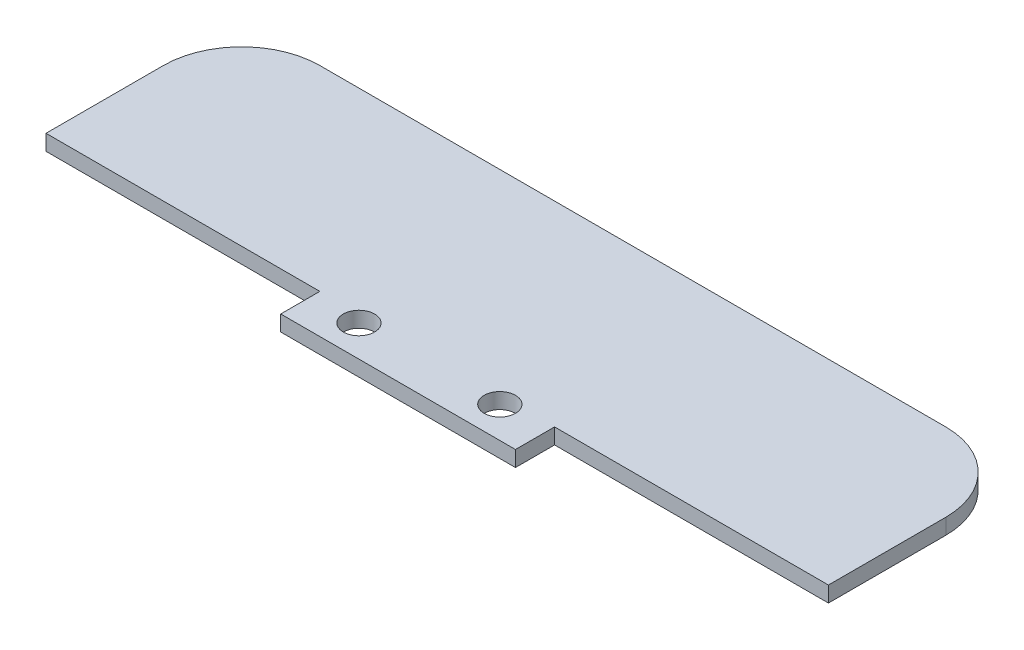
from build123d import *

# Parameters (mm, degrees)
SKETCH1_R           = 2
BOSS_EXTRUDE1_DEPTH = 2
FILLET1_R           = 10


with BuildPart() as part:
    # Sketch1 → Boss-Extrude1 (new body)
    with BuildSketch(Plane(origin=(0, 0, 0), x_dir=(1, 0, 0), z_dir=(0, 1, 0))):
        Polygon((50, 12.5), (50, -12.5), (15, -12.5), (15, -17.5), (-15, -17.5), (-15, -12.5), (-50, -12.5), (-50, 12.5), align=None)
        with Locations(Location((-9, -13.5, 0), (0, 0, 270))):
            Circle(SKETCH1_R, mode=Mode.SUBTRACT)
        with Locations(Location((9, -13.5, 0), (0, 0, 270))):
            Circle(SKETCH1_R, mode=Mode.SUBTRACT)
    extrude(amount=BOSS_EXTRUDE1_DEPTH)

    # Fillet1
    fillet1_edges = [part.edges().sort_by_distance(p)[0] for p in [
        (-50, 1, -12.5),
        (50, 1, -12.5),
    ]]
    fillet(fillet1_edges, radius=FILLET1_R)


solid = part.part
